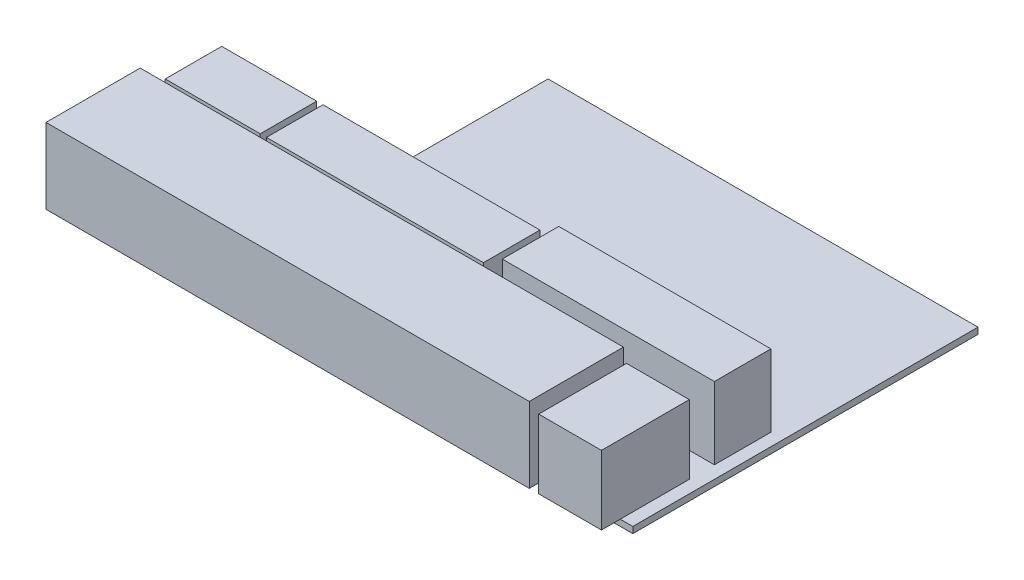
from build123d import *

# Parameters (mm, degrees)
BOSS_EXTRUDE1_DEPTH   = 1
SKETCH2_W             = 77
SKETCH2_H             = 15
BOSS_EXTRUDE2_DEPTH   = 12
SKETCH3_W             = 10
SKETCH3_H             = 14
BOSS_EXTRUDE3_DEPTH   = 11
SKETCH4_W             = 15.133908349
SKETCH4_H             = 9
BOSS_EXTRUDE4_DEPTH   = 11.5
SKETCH4_W_2           = 34.567081878
BOSS_EXTRUDE4_2_DEPTH = 11.5
SKETCH4_W_3           = 33.799009773
BOSS_EXTRUDE4_3_DEPTH = 11.5


with BuildPart() as part:
    # Sketch1 → Boss-Extrude1 (new body)
    with BuildSketch(Plane(origin=(0, 0, 0), x_dir=(1, 0, 0), z_dir=(0, 1, 0))):
        Polygon((-46.9670263, -0.627662529), (-21.9670263, -0.627662529), (-21.9670263, 27.372337471), (46.5329737, 27.372337471), (46.5329737, -27.627662529), (-46.9670263, -27.627662529), align=None)
    extrude(amount=BOSS_EXTRUDE1_DEPTH)

    # Sketch2 → Boss-Extrude2 (add)
    with BuildSketch(Plane(origin=(0, 1, 0), x_dir=(1, 0, 0), z_dir=(0, 1, 0))):
        with Locations((-5.4670263, -23.127662529)):
            Rectangle(SKETCH2_W, SKETCH2_H)
    extrude(amount=BOSS_EXTRUDE2_DEPTH)

    # Sketch3 → Boss-Extrude3 (add)
    with BuildSketch(Plane(origin=(0, 1, 0), x_dir=(1, 0, 0), z_dir=(0, 1, 0))):
        with Locations((39.5329737, -23.627662529)):
            Rectangle(SKETCH3_W, SKETCH3_H)
    extrude(amount=BOSS_EXTRUDE3_DEPTH)


with BuildPart() as body_2:
    # Sketch4 → Boss-Extrude4 (new body)
    with BuildSketch(Plane(origin=(0, 1, 0), x_dir=(1, 0, 0), z_dir=(0, 1, 0))):
        with Locations((-33.400072126, -10.127662529)):
            Rectangle(SKETCH4_W, SKETCH4_H)
    extrude(amount=BOSS_EXTRUDE4_DEPTH)


with BuildPart() as body_3:
    # Sketch4 → Boss-Extrude4 2 (new body)
    with BuildSketch(Plane(origin=(0, 1, 0), x_dir=(1, 0, 0), z_dir=(0, 1, 0))):
        with Locations((-7.549577012, -10.127662529)):
            Rectangle(SKETCH4_W_2, SKETCH4_H)
    extrude(amount=BOSS_EXTRUDE4_2_DEPTH)


with BuildPart() as body_4:
    # Sketch4 → Boss-Extrude4 3 (new body)
    with BuildSketch(Plane(origin=(0, 1, 0), x_dir=(1, 0, 0), z_dir=(0, 1, 0))):
        with Locations((27.633468814, -8.127662529)):
            Rectangle(SKETCH4_W_3, SKETCH4_H)
    extrude(amount=BOSS_EXTRUDE4_3_DEPTH)


solid = Compound([part.part, body_2.part, body_3.part, body_4.part])
